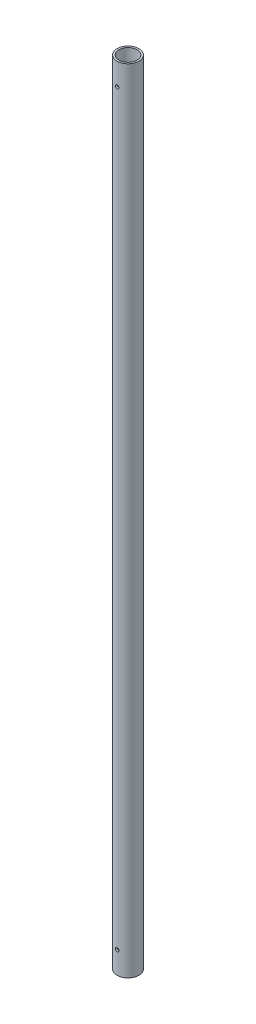
from build123d import *

# Parameters (mm, degrees)
SKETCH1_R                                 = 21.082
SKETCH1_R_2                               = 17.526
BOSS_EXTRUDE1_DEPTH                       = 1530.35
SKETCH4_W                                 = 3.373501
SKETCH4_H                                 = 21.082
F_17_64_0_26563_DIAMETER_HOLE1_AT_2_COUNT = 2
F_17_64_0_26563_DIAMETER_HOLE1_AT_2_PITCH = 1444.40656
F_17_64_0_26563_DIAMETER_HOLE2_D          = 6.747002


with BuildPart() as part:
    # Sketch1 → Boss-Extrude1 (new body)
    with BuildSketch(Plane(origin=(0, 0, 0), x_dir=(1, 0, 0), z_dir=(0, 1, 0))):
        with Locations(Location((0, 0, 0), (0, 0, 270))):
            Circle(SKETCH1_R)
        with Locations(Location((0, 0, 0), (0, 0, 270))):
            Circle(SKETCH1_R_2, mode=Mode.SUBTRACT)
    extrude(amount=BOSS_EXTRUDE1_DEPTH)

    # Sketch4 → 17/64 (0.26563) Diameter Hole1 (revolve, cut)
    with BuildSketch(Plane(origin=(0, 42.97172, 0), x_dir=(0, 1, 0), z_dir=(1, 0, 0))):
        with Locations((1.6867505, 10.541)):
            Rectangle(SKETCH4_W, SKETCH4_H)
    f_17_64_0_26563_diameter_hole1 = revolve(axis=Axis((0, 42.97172, -6.35), (0, 0, 1)), mode=Mode.SUBTRACT)

    # 17/64 (0.26563) Diameter Hole1 at 2: 17/64 (0.26563) Diameter Hole1 ×2
    with Locations(*[(0, i * F_17_64_0_26563_DIAMETER_HOLE1_AT_2_PITCH, 0) for i in range(1, F_17_64_0_26563_DIAMETER_HOLE1_AT_2_COUNT)]):
        add(f_17_64_0_26563_diameter_hole1, mode=Mode.SUBTRACT)

    # 17/64 (0.26563) Diameter Hole2 (through all)
    with Locations(Plane.XY):
        with Locations((0, 1487.37828), (0, 42.97172)):
            Hole(F_17_64_0_26563_DIAMETER_HOLE2_D / 2)


solid = part.part
